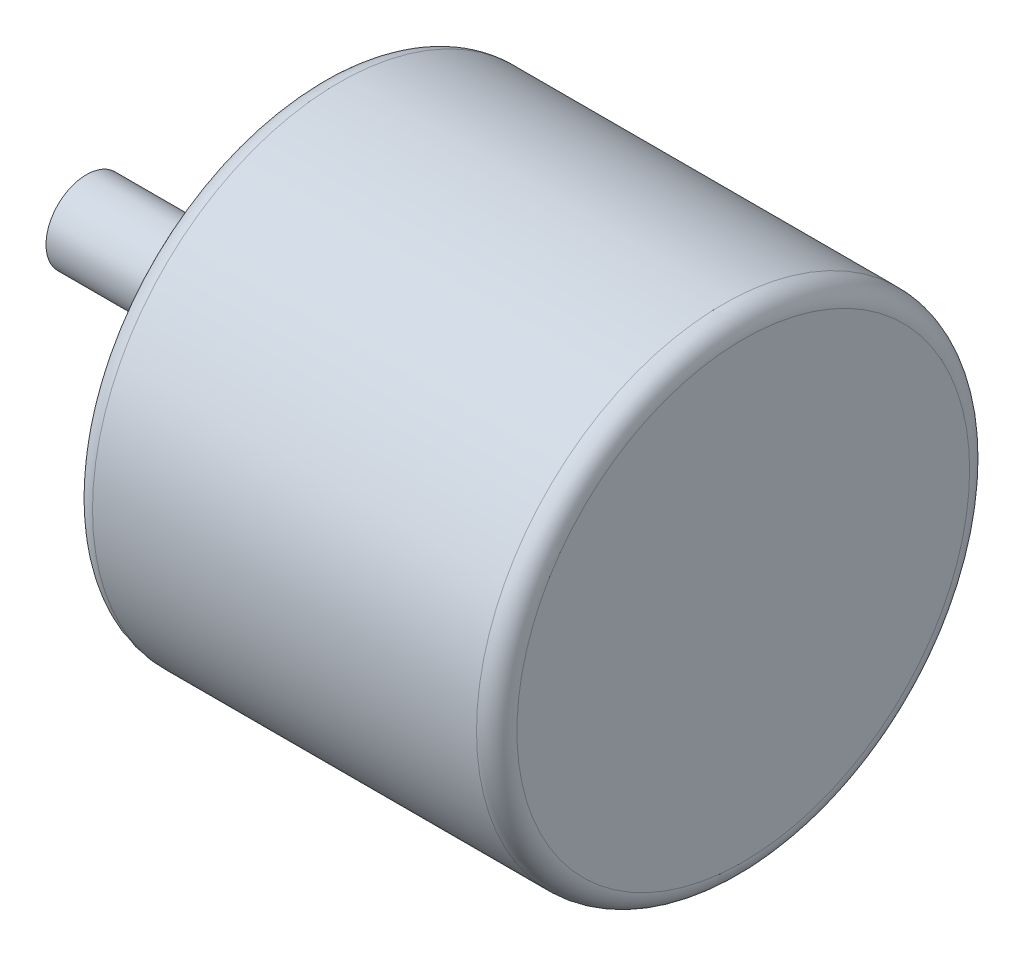
from build123d import *

# Parameters (mm, degrees)
SKETCH_1_R      = 12.2
EXTRUDE_1_DEPTH = 21
FILLET_1_R      = 1
SKETCH_2_R      = 3.5
EXTRUDE_2_DEPTH = 2.5
SKETCH_3_R      = 2
EXTRUDE_3_DEPTH = 9


with BuildPart() as part:
    # 草图1 → 凸台-拉伸1 (new body)
    with BuildSketch(Plane(origin=(0, 0, 0), x_dir=(0, 0, -1), z_dir=(1, 0, 0))):
        with Locations(Location((0, 0, 0), (0, 0, 180))):
            Circle(SKETCH_1_R)
    extrude(amount=EXTRUDE_1_DEPTH)

    # 圆角1
    fillet_1_edges = [part.edges().sort_by_distance(p)[0] for p in [
        (0, 0, -12.2),
        (21, 0, -12.2),
    ]]
    fillet(fillet_1_edges, radius=FILLET_1_R)

    # 草图2 → 凸台-拉伸2 (add)
    with BuildSketch(Plane.ZY):
        with Locations(Location((0, 0, 0), (0, 0, 180))):
            Circle(SKETCH_2_R)
    extrude(amount=EXTRUDE_2_DEPTH)

    # 草图3 → 凸台-拉伸3 (add)
    with BuildSketch(Plane.ZY.offset(2.5)):
        Circle(SKETCH_3_R)
    extrude(amount=EXTRUDE_3_DEPTH)


solid = part.part
